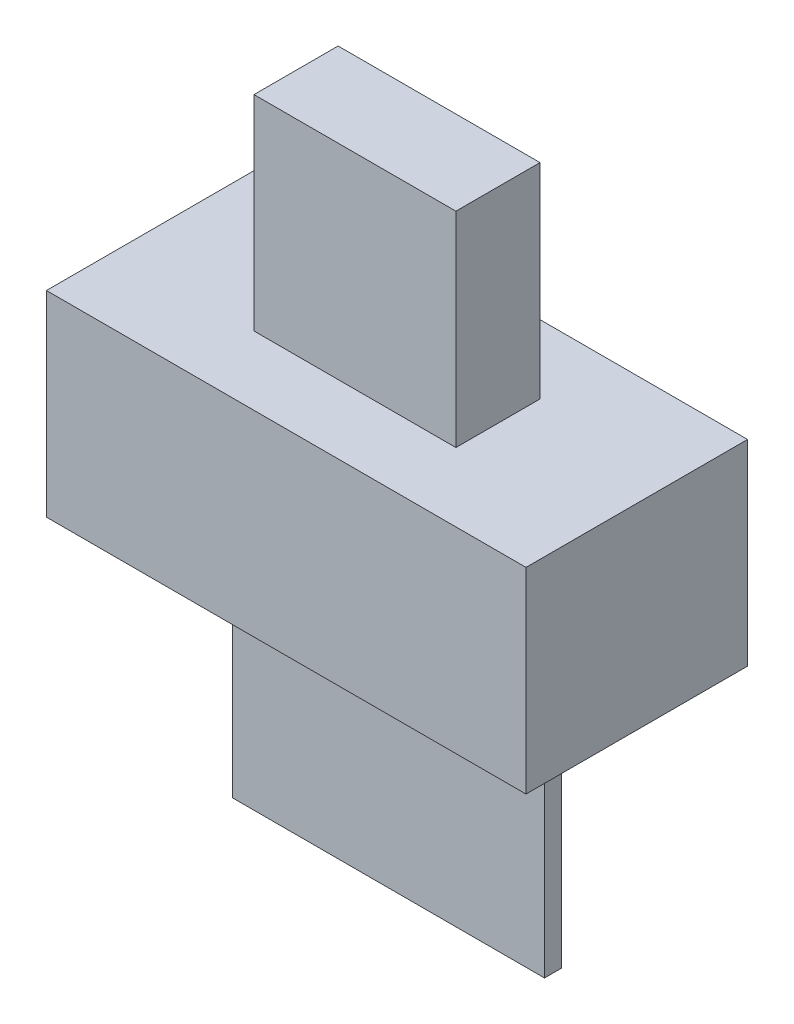
from build123d import *

# Parameters (mm, degrees)
SKETCH_1_W      = 8.55
SKETCH_1_H      = 3.5
EXTRUDE_1_DEPTH = 3.95
SKETCH_2_W      = 3.6
SKETCH_2_H      = 1.5
EXTRUDE_2_DEPTH = 3.65
SKETCH_3_W      = 5.56
SKETCH_3_H      = 0.3
EXTRUDE_3_DEPTH = 4.5


with BuildPart() as part:
    # 草图1 → 凸台-拉伸1 (new body)
    with BuildSketch(Plane.XY):
        with Locations((4.275, 1.75)):
            Rectangle(SKETCH_1_W, SKETCH_1_H)
    extrude(amount=EXTRUDE_1_DEPTH)

    # 草图2 → 凸台-拉伸2 (add)
    with BuildSketch(Plane(origin=(0, 3.5, 0), x_dir=(1, 0, 0), z_dir=(0, 1, 0))):
        with Locations((4.275, -1.975)):
            Rectangle(SKETCH_2_W, SKETCH_2_H)
    extrude(amount=EXTRUDE_2_DEPTH)

    # 草图3 → 凸台-拉伸3 (add)
    with BuildSketch(Plane.XZ):
        with Locations((4.275, 1.975)):
            Rectangle(SKETCH_3_W, SKETCH_3_H)
    extrude(amount=EXTRUDE_3_DEPTH)


solid = part.part
